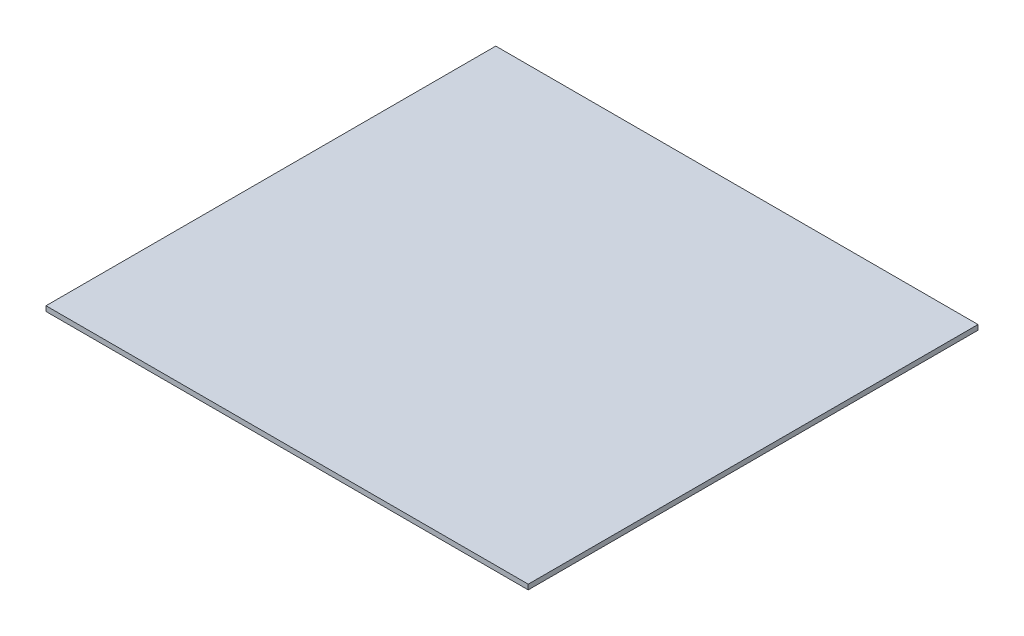
from build123d import *

# Parameters (mm, degrees)
SKETCH1_W           = 9.65
SKETCH1_H           = 9
BOSS_EXTRUDE1_DEPTH = 0.1


with BuildPart() as part:
    # Sketch1 → Boss-Extrude1 (new body)
    with BuildSketch(Plane(origin=(0, 0, 0), x_dir=(1, 0, 0), z_dir=(0, 1, 0))):
        Rectangle(SKETCH1_W, SKETCH1_H)
    extrude(amount=BOSS_EXTRUDE1_DEPTH)


solid = part.part
